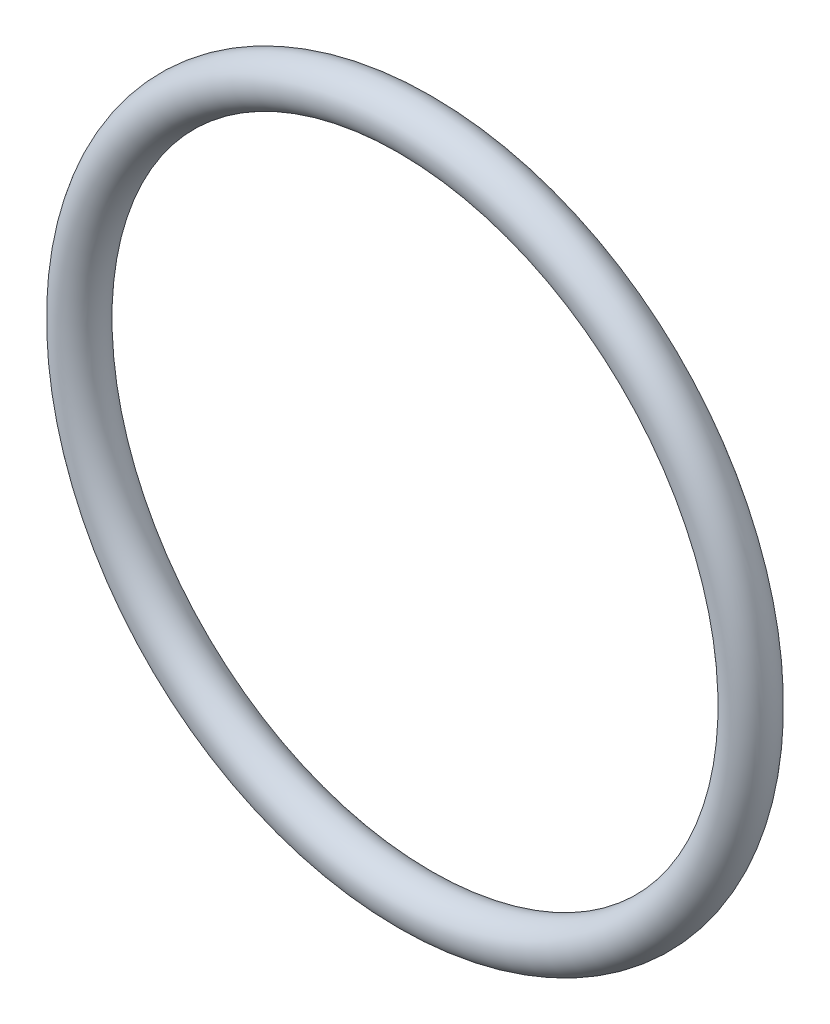
from build123d import *

# Parameters (mm, degrees)
ESQUISSE17_R = 2


with BuildPart() as part:
    # Balayage2: sweep along a path in Esquisse1
    with BuildLine(Plane.XY) as balayage2_path:
        CenterArc((0, 0), 28, 0, 360)
    # Esquisse17 → Balayage2 (sweep)
    with BuildSketch(Plane(origin=(0, 0, 0), x_dir=(0, 0, -1), z_dir=(1, 0, 0))):
        with Locations((0, 29)):
            Circle(ESQUISSE17_R)
    sweep(path=balayage2_path.line)


solid = part.part
